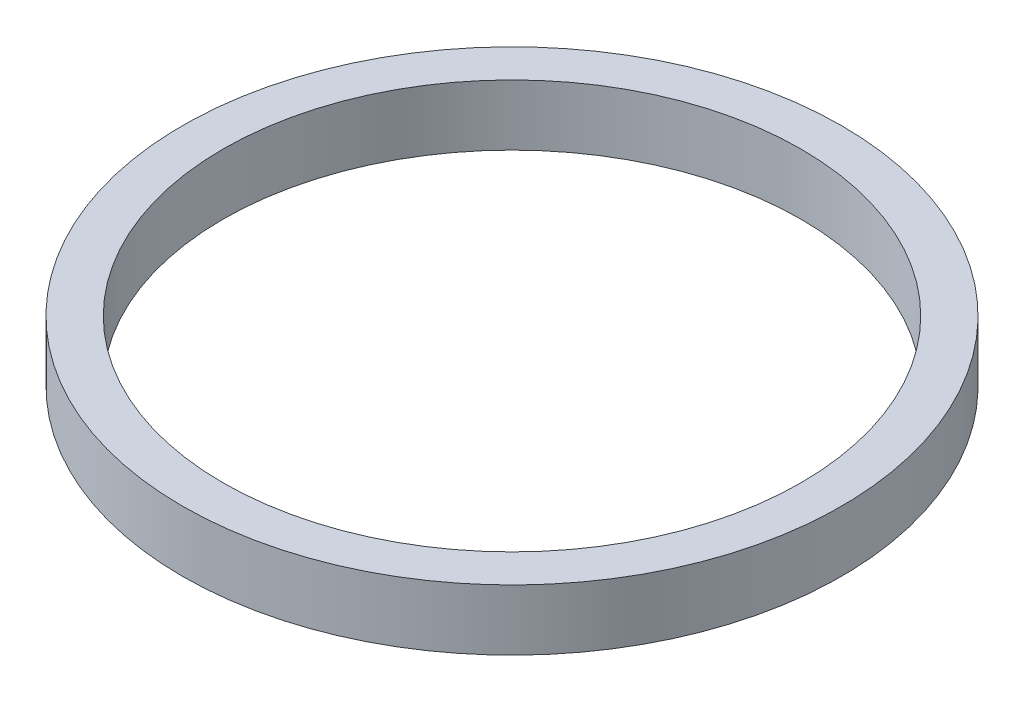
from build123d import *

# Parameters (mm, degrees)
SKETCH1_R           = 16.2625
SKETCH1_R_2         = 14.2625
BOSS_EXTRUDE1_DEPTH = 3


with BuildPart() as part:
    # Sketch1 → Boss-Extrude1 (new body)
    with BuildSketch(Plane(origin=(0, 0, 0), x_dir=(1, 0, 0), z_dir=(0, 1, 0))):
        with Locations(Location((0, 0, 0), (0, 0, 270))):
            Circle(SKETCH1_R)
        with Locations(Location((0, 0, 0), (0, 0, 270))):
            Circle(SKETCH1_R_2, mode=Mode.SUBTRACT)
    extrude(amount=BOSS_EXTRUDE1_DEPTH)


solid = part.part
